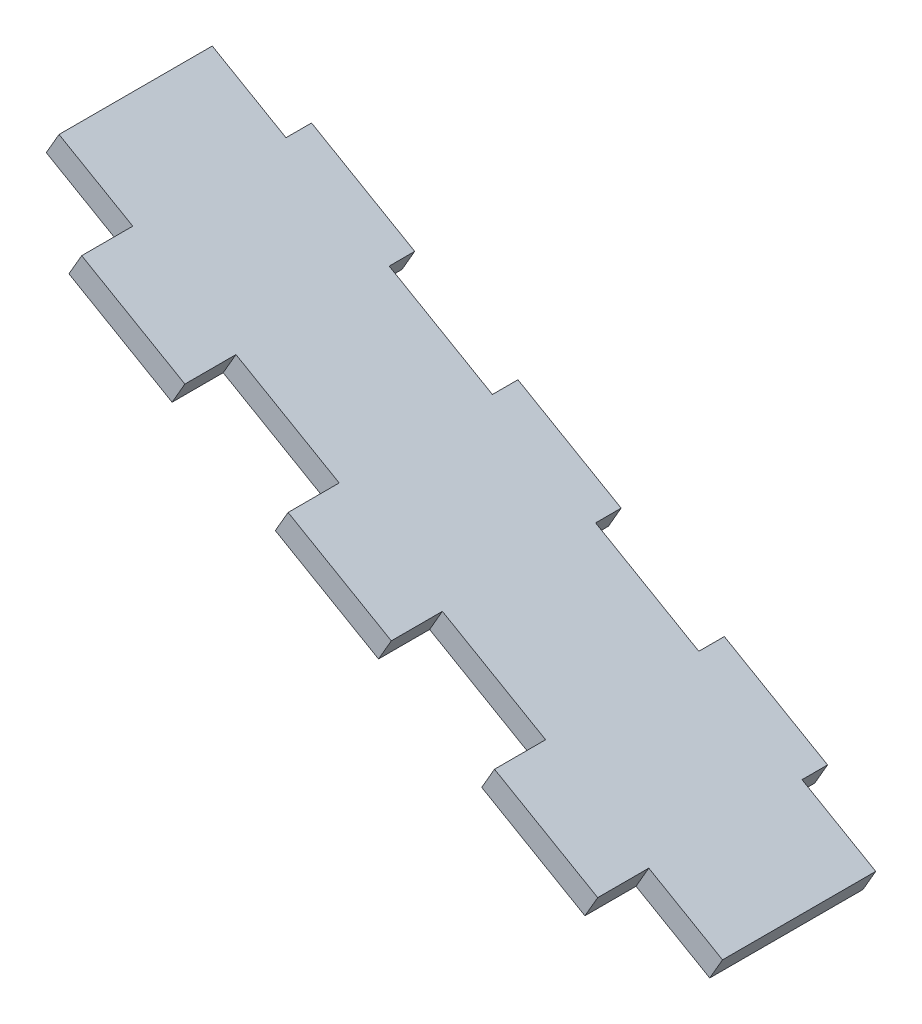
from build123d import *

# Parameters (mm, degrees)
BOSS_EXTRU_1_DEPTH      = 36
BOSS_EXTRU_2_DEPTH      = 6
BOSS_EXTRU_2_DEPTH_BACK = 48


with BuildPart() as part:
    # Esquisse1 → Boss.-Extru.1 (new body)
    with BuildSketch(Plane.XY):
        Polygon((6.070596481, -169.485418462), (-149.8139762, -79.485418462), (-146.8139762, -74.28926604), (9.070596481, -164.28926604), align=None)
    extrude(amount=BOSS_EXTRU_1_DEPTH)

    # Esquisse3 → Boss.-Extru.2 (add, two sides: drawn at the far end of the back side and taken through both)
    with BuildSketch(Plane(origin=(0, 0, 0), x_dir=(-1, 0, 0), z_dir=(0, 0, -1)).offset(-BOSS_EXTRU_2_DEPTH_BACK)):
        Polygon((32.4986229, -140.28926604), (8.249911594, -154.28926604), (11.249911594, -159.485418462), (35.4986229, -145.485418462), align=None)
        Polygon((68.871689859, -119.28926604), (56.747334206, -126.28926604), (59.747334206, -131.485418462), (71.871689859, -124.485418462), align=None)
        Polygon((80.996045512, -112.28926604), (68.871689859, -119.28926604), (71.871689859, -124.485418462), (83.996045512, -117.485418462), align=None)
        Polygon((129.493468124, -84.28926604), (105.244756818, -98.28926604), (108.244756818, -103.485418462), (132.493468124, -89.485418462), align=None)
    extrude(amount=BOSS_EXTRU_2_DEPTH + BOSS_EXTRU_2_DEPTH_BACK)


solid = part.part
